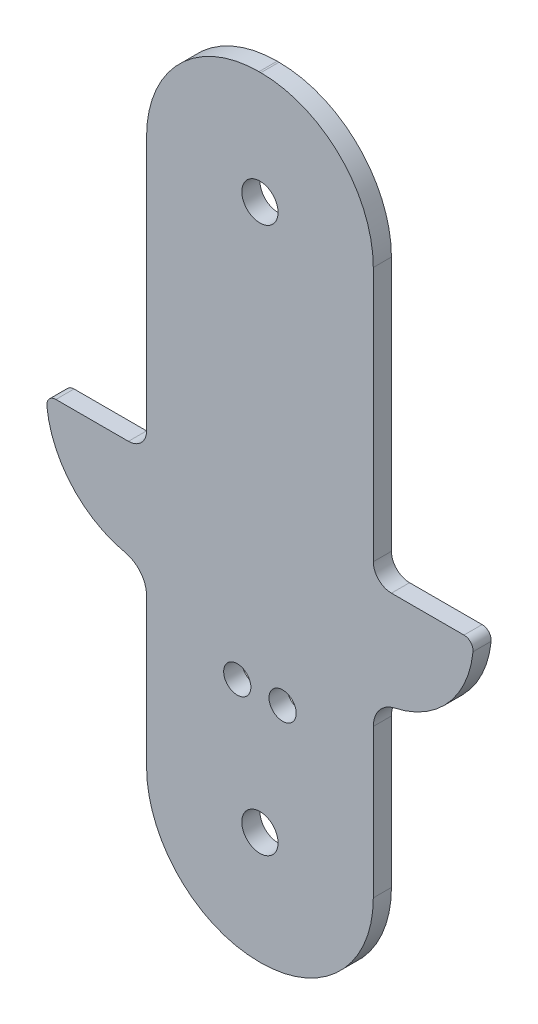
from build123d import *

# Parameters (mm, degrees)
SKETCH1_R           = 2
SKETCH1_R_2         = 1.5
BOSS_EXTRUDE1_DEPTH = 2


with BuildPart() as part:
    # Sketch1 → Boss-Extrude1 (new body)
    with BuildSketch(Plane.XY):
        with BuildLine():
            Line((12.4, 0), (12.6, 0))
            ThreePointArc((12.6, 0), (21.368124087, 3.631875913), (25, 12.4))
            Line((25, 12.4), (25, 28.774148297))
            ThreePointArc((25, 28.774148297), (25.663151139, 30.655407822), (27.359424934, 31.704961083))
            ThreePointArc((27.359424934, 31.704961083), (33.251440199, 35.15061323), (35.99503719, 41.400496281))
            ThreePointArc((35.99503719, 41.400496281), (35.741452534, 42.171005321), (35, 42.5))
            Line((35, 42.5), (27, 42.5))
            ThreePointArc((27, 42.5), (25.585786438, 43.085786438), (25, 44.5))
            Line((25, 44.5), (25, 72.6))
            ThreePointArc((25, 72.6), (21.368124087, 81.368124087), (12.6, 85))
            Line((12.6, 85), (12.4, 85))
            ThreePointArc((12.4, 85), (3.631875913, 81.368124087), (0, 72.6))
            Line((0, 72.6), (0, 44.5))
            ThreePointArc((0, 44.5), (-0.585786438, 43.085786438), (-2, 42.5))
            Line((-2, 42.5), (-10, 42.5))
            ThreePointArc((-10, 42.5), (-10.741452534, 42.171005321), (-10.99503719, 41.400496281))
            ThreePointArc((-10.99503719, 41.400496281), (-8.251440199, 35.15061323), (-2.359424934, 31.704961083))
            ThreePointArc((-2.359424934, 31.704961083), (-0.663151139, 30.655407822), (0, 28.774148297))
            Line((0, 28.774148297), (0, 12.4))
            ThreePointArc((0, 12.4), (3.631875913, 3.631875913), (12.4, 0))
        make_face()
        with Locations((12.5, 72.6)):
            Circle(SKETCH1_R, mode=Mode.SUBTRACT)
        with Locations((12.5, 12.4)):
            Circle(SKETCH1_R, mode=Mode.SUBTRACT)
        with Locations((10, 25.767183826)):
            Circle(SKETCH1_R_2, mode=Mode.SUBTRACT)
        with Locations((15, 25.767183826)):
            Circle(SKETCH1_R_2, mode=Mode.SUBTRACT)
    extrude(amount=BOSS_EXTRUDE1_DEPTH)


solid = part.part
